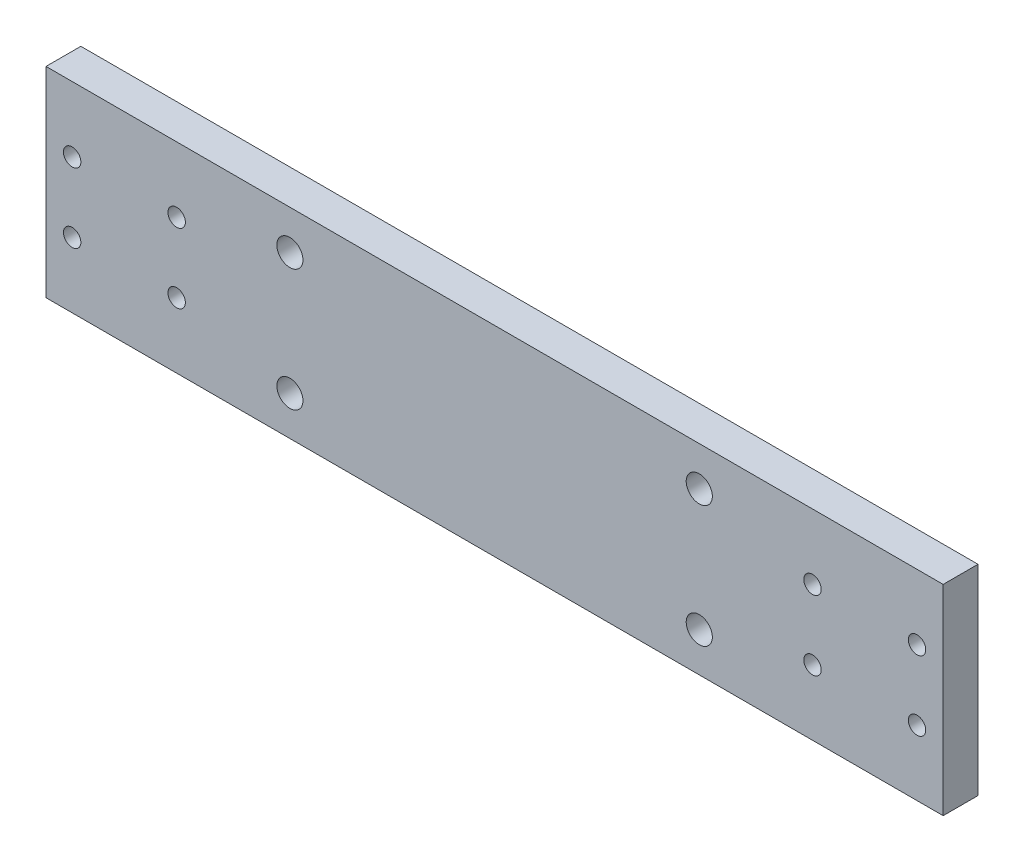
from build123d import *

# Parameters (mm, degrees)
SKETCH_1_W      = 103
SKETCH_1_H      = 23
SKETCH_1_R      = 1.5
SKETCH_1_R_2    = 1
EXTRUDE_1_DEPTH = 4


with BuildPart() as part:
    # 草图1 → 凸台-拉伸1 (new body)
    with BuildSketch(Plane.XY):
        Rectangle(SKETCH_1_W, SKETCH_1_H)
        with Locations((-23.5, 7)):
            Circle(SKETCH_1_R, mode=Mode.SUBTRACT)
        with Locations((-23.5, -7)):
            Circle(SKETCH_1_R, mode=Mode.SUBTRACT)
        with Locations((23.5, 7)):
            Circle(SKETCH_1_R, mode=Mode.SUBTRACT)
        with Locations((23.5, -7)):
            Circle(SKETCH_1_R, mode=Mode.SUBTRACT)
        with Locations((-48.5, 4)):
            Circle(SKETCH_1_R_2, mode=Mode.SUBTRACT)
        with Locations((-36.5, 4)):
            Circle(SKETCH_1_R_2, mode=Mode.SUBTRACT)
        with Locations((-36.5, -4)):
            Circle(SKETCH_1_R_2, mode=Mode.SUBTRACT)
        with Locations((-48.5, -4)):
            Circle(SKETCH_1_R_2, mode=Mode.SUBTRACT)
        with Locations((36.5, 4)):
            Circle(SKETCH_1_R_2, mode=Mode.SUBTRACT)
        with Locations((48.5, 4)):
            Circle(SKETCH_1_R_2, mode=Mode.SUBTRACT)
        with Locations((48.5, -4)):
            Circle(SKETCH_1_R_2, mode=Mode.SUBTRACT)
        with Locations((36.5, -4)):
            Circle(SKETCH_1_R_2, mode=Mode.SUBTRACT)
    extrude(amount=EXTRUDE_1_DEPTH)


solid = part.part
